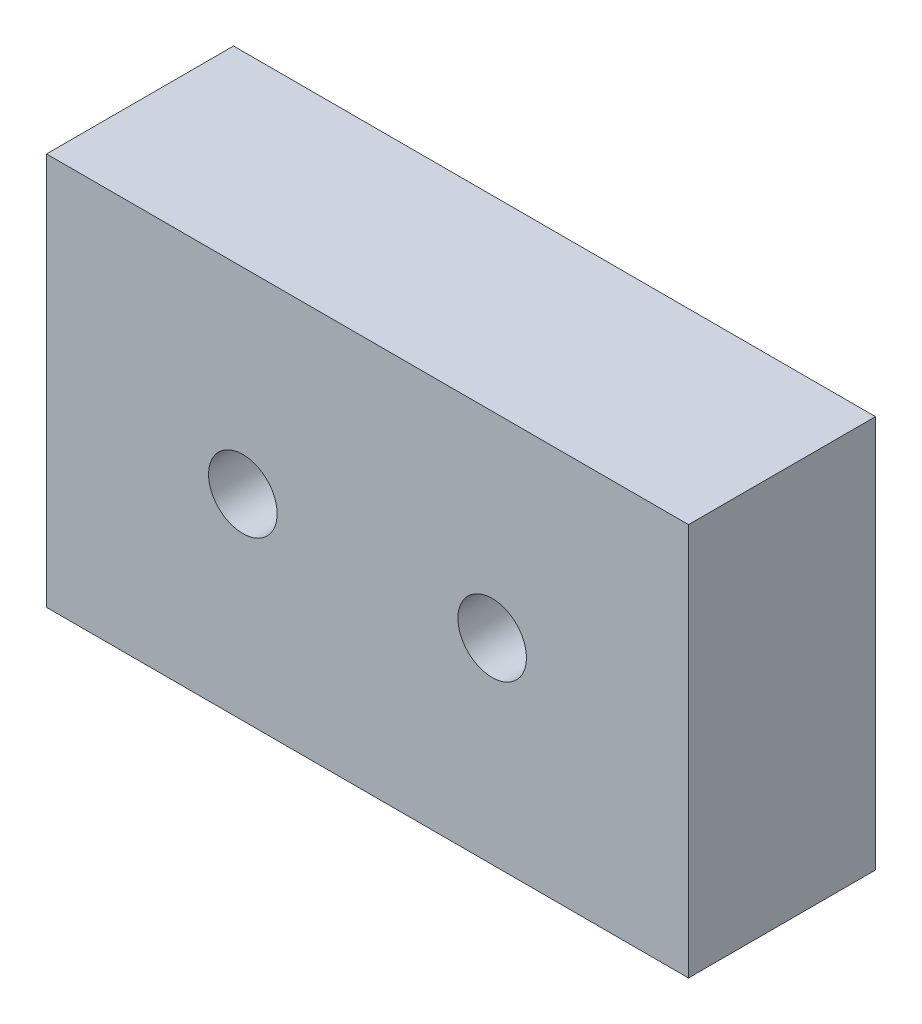
from build123d import *

# Parameters (mm, degrees)
ESQUISSE1_W             = 41.2
ESQUISSE1_H             = 25.2
BOSS_EXTRU_1_DEPTH      = 12
ESQUISSE2_R             = 2.2
ENL_V_MAT_EXTRU_1_DEPTH = 12


with BuildPart() as part:
    # Esquisse1 → Boss.-Extru.1 (new body)
    with BuildSketch(Plane.XY):
        Rectangle(ESQUISSE1_W, ESQUISSE1_H)
    extrude(amount=BOSS_EXTRU_1_DEPTH)

    # Esquisse2 → Enlèv. mat.-Extru.1 (cut)
    with BuildSketch(Plane.XY):
        with Locations((8, 0)):
            Circle(ESQUISSE2_R)
        with Locations((-8, 0)):
            Circle(ESQUISSE2_R)
    extrude(amount=ENL_V_MAT_EXTRU_1_DEPTH, mode=Mode.SUBTRACT)


solid = part.part
